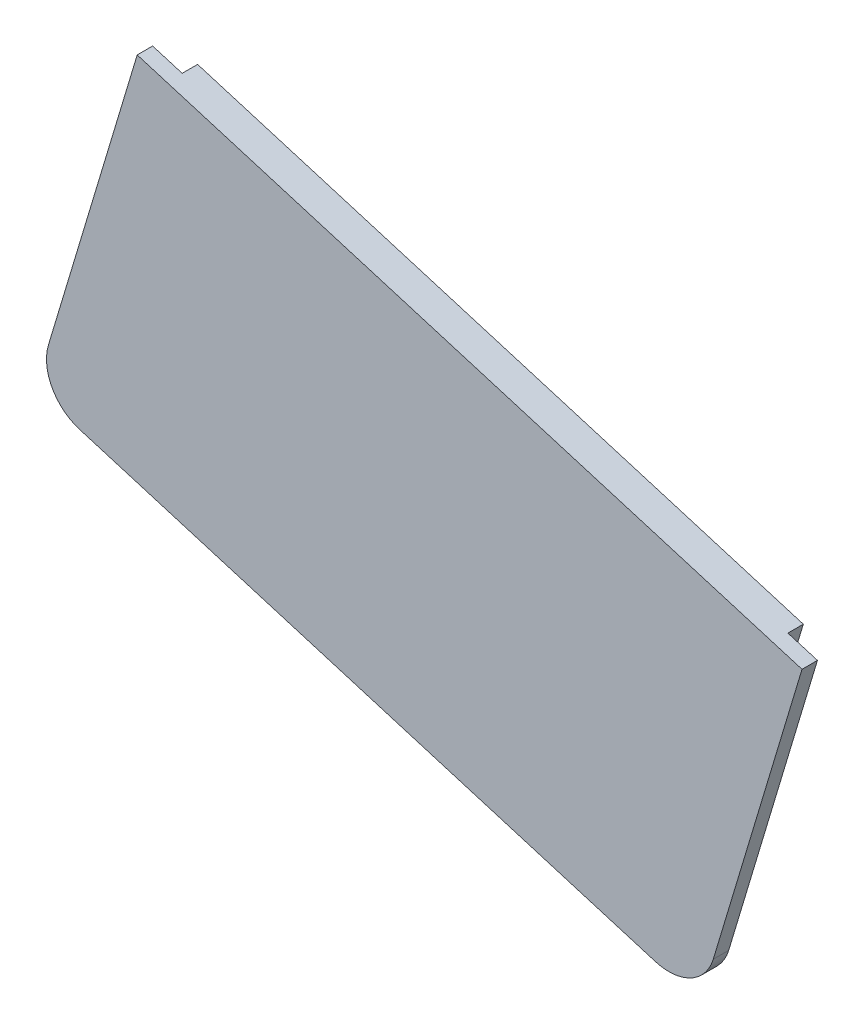
from build123d import *

# Parameters (mm, degrees)
BOSS_EXTRUDE1_DEPTH = 1
BOSS_EXTRUDE2_DEPTH = 1
CUT_EXTRUDE1_DEPTH  = 10


with BuildPart() as part:
    # Sketch1 → Boss-Extrude1 (new body)
    with BuildSketch(Plane.XY):
        with BuildLine():
            ThreePointArc((3432.575330737, -38.576109077), (3432.498215735, -37.814637007), (3431.90524513, -37.330723482))
            Line((3431.90524513, -37.330723482), (3394.553556699, -26.112373721))
            ThreePointArc((3394.553556699, -26.112373721), (3393.792084629, -26.189488722), (3393.308171105, -26.782459328))
            Line((3393.308171105, -26.782459328), (3383.528071313, -59.345469754))
            ThreePointArc((3383.528071313, -59.345469754), (3383.605186314, -60.106941825), (3384.198156919, -60.590855349))
            Line((3384.198156919, -60.590855349), (3421.54984535, -71.809205111))
            ThreePointArc((3421.54984535, -71.809205111), (3422.311317421, -71.732090109), (3422.795230945, -71.139119504))
            Line((3422.795230945, -71.139119504), (3432.575330737, -38.576109077))
        make_face()
    extrude(amount=-BOSS_EXTRUDE1_DEPTH)

    # Sketch1<4> → Boss-Extrude2 (add)
    with BuildSketch(Plane.XY):
        with BuildLine():
            ThreePointArc((3395.128856687, -24.196902519), (3392.844440476, -24.428247524), (3391.392699903, -26.20715934))
            Line((3391.392699903, -26.20715934), (3381.612600111, -58.770169767))
            ThreePointArc((3381.612600111, -58.770169767), (3381.843945116, -61.054585978), (3383.622856932, -62.506326551))
            Line((3383.622856932, -62.506326551), (3420.974545362, -73.724676312))
            ThreePointArc((3420.974545362, -73.724676312), (3423.258961574, -73.493331308), (3424.710702146, -71.714419492))
            Line((3424.710702146, -71.714419492), (3434.490801939, -39.151409065))
            ThreePointArc((3434.490801939, -39.151409065), (3434.259456934, -36.866992853), (3432.480545118, -35.415252281))
            Line((3432.480545118, -35.415252281), (3395.128856687, -24.196902519))
        make_face()
    extrude(amount=BOSS_EXTRUDE2_DEPTH)

    # Sketch2 → Cut-Extrude1 (cut)
    with BuildSketch(Plane(origin=(0, 0, -1), x_dir=(-1, 0, 0), z_dir=(0, 0, -1))):
        Polygon((-3455.741612738, -34.933179244), (-3387.643444689, -14.48031354), (-3380.69590789, -37.612256774), (-3448.79407594, -58.065122478), align=None)
    extrude(amount=-CUT_EXTRUDE1_DEPTH, mode=Mode.SUBTRACT)


solid = part.part
